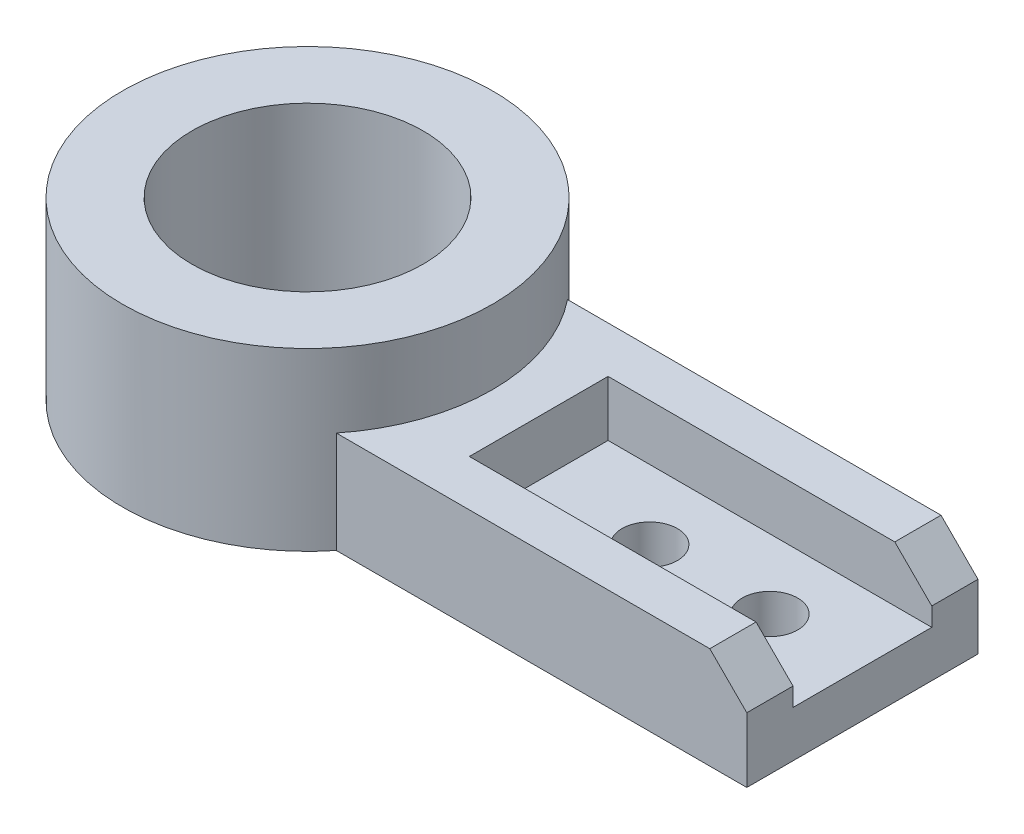
from build123d import *

# Parameters (mm, degrees)
SKETCH1_R           = 62.5
BOSS_EXTRUDE1_DEPTH = 25
SKETCH1_3_R         = 62.5
BOSS_EXTRUDE2_DEPTH = 55
SKETCH1_4_R         = 62.5
BOSS_EXTRUDE3_DEPTH = 95
SKETCH3_R           = 15
CUT_EXTRUDE1_DEPTH  = 324.882694814
CHAMFER1_SIZE       = 20


with BuildPart() as part:
    # Sketch1 → Boss-Extrude1 (new body)
    with BuildSketch(Plane(origin=(0, 0, 0), x_dir=(1, 0, 0), z_dir=(0, 1, 0))):
        with BuildLine():
            Line((300, 62.5), (78.06247498, 62.5))
            ThreePointArc((78.06247498, 62.5), (-100, 0), (78.06247498, -62.5))
            Line((78.06247498, -62.5), (300, -62.5))
            Line((300, -62.5), (300, 62.5))
        make_face()
        Circle(SKETCH1_R, mode=Mode.SUBTRACT)
    extrude(amount=BOSS_EXTRUDE1_DEPTH)

    # Sketch1<3> → Boss-Extrude2 (add)
    with BuildSketch(Plane(origin=(0, 0, 0), x_dir=(1, 0, 0), z_dir=(0, 1, 0))):
        with BuildLine():
            Line((300, 62.5), (78.06247498, 62.5))
            ThreePointArc((78.06247498, 62.5), (-100, 0), (78.06247498, -62.5))
            Line((78.06247498, -62.5), (300, -62.5))
            Line((300, -62.5), (300, -37.5))
            Line((300, -37.5), (125, -37.5))
            Line((125, -37.5), (125, 37.5))
            Line((125, 37.5), (300, 37.5))
            Line((300, 37.5), (300, 62.5))
        make_face()
        Circle(SKETCH1_3_R, mode=Mode.SUBTRACT)
    extrude(amount=BOSS_EXTRUDE2_DEPTH)

    # Sketch1<4> → Boss-Extrude3 (add)
    with BuildSketch(Plane(origin=(0, 0, 0), x_dir=(1, 0, 0), z_dir=(0, 1, 0))):
        with BuildLine():
            ThreePointArc((100, 0), (94.356365705, 33.119122135), (78.06247498, 62.5))
            ThreePointArc((78.06247498, 62.5), (-100, 0), (78.06247498, -62.5))
            ThreePointArc((78.06247498, -62.5), (94.356365705, -33.119122135), (100, 0))
        make_face()
        Circle(SKETCH1_4_R, mode=Mode.SUBTRACT)
    extrude(amount=BOSS_EXTRUDE3_DEPTH)

    # Sketch3 → Cut-Extrude1 (cut, through all)
    with BuildSketch(Plane(origin=(0, 25, 0), x_dir=(1, 0, 0), z_dir=(0, 1, 0))):
        with Locations((250, 0)):
            Circle(SKETCH3_R)
        with Locations((185, 0)):
            Circle(SKETCH3_R)
    extrude(amount=-CUT_EXTRUDE1_DEPTH, mode=Mode.SUBTRACT)

    # Chamfer1
    chamfer1_edges = [part.edges().sort_by_distance(p)[0] for p in [
        (300, 55, 50),
        (300, 55, -50),
    ]]
    chamfer(chamfer1_edges, length=CHAMFER1_SIZE)


solid = part.part
